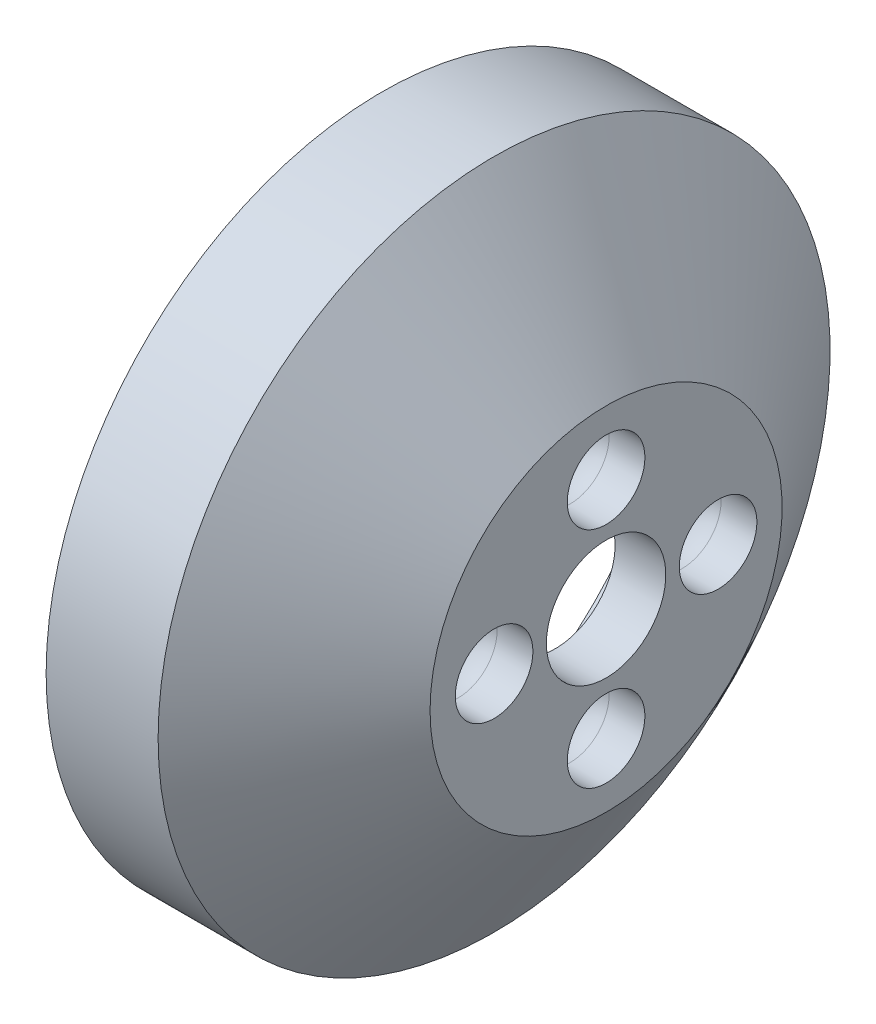
from build123d import *

# Parameters (mm, degrees)
SKETCH2_R          = 6.604
CUT_EXTRUDE1_DEPTH = 12.7
FILLET1_R          = 6.604
CHAMFER1_SIZE      = 33.02
CHAMFER1_SIZE2     = 23.120852912


with BuildPart() as part:
    # Sketch1 → Revolve1 (revolve)
    with BuildSketch(Plane.XY, mode=Mode.PRIVATE) as revolve1_sk:
        Polygon((0, 51.054), (0, 10.16), (31.75, 10.16), (31.75, 29.943780472), (12.7, 57.15), (-6.35, 57.15), (-6.35, 51.054), align=None)
    revolve(revolve1_sk.sketch.rotate(Axis((0, 0, 0), (1, 0, 0)), 90), axis=Axis((0, 0, 0), (1, 0, 0)))

    # Sketch2 → Cut-Extrude1 (cut)
    with BuildSketch(Plane(origin=(31.75, 0, 0), x_dir=(0, 0, -1), z_dir=(1, 0, 0))):
        with Locations((-19.05, 0)):
            Circle(SKETCH2_R)
        with Locations((0, 19.05)):
            Circle(SKETCH2_R)
        with Locations((19.05, 0)):
            Circle(SKETCH2_R)
        with Locations((0, -19.05)):
            Circle(SKETCH2_R)
    extrude(amount=-CUT_EXTRUDE1_DEPTH, mode=Mode.SUBTRACT)

    # Fillet1
    fillet1_edges = [part.edges().sort_by_distance(p)[0] for p in [
        (19.05, 0, 25.654),
        (19.05, 19.05, 6.604),
        (19.05, 0, -12.446),
        (19.05, -19.05, 6.604),
    ]]
    fillet(fillet1_edges, radius=FILLET1_R)

    # Chamfer1
    chamfer1_edges = [part.edges().sort_by_distance(p)[0] for p in [
        (0, 0, -10.16),
    ]]
    chamfer1_side = [part.faces().sort_by_distance(p)[0] for p in [
        (0, 0, -49.609974816),
    ]]
    chamfer(chamfer1_edges, length=CHAMFER1_SIZE, length2=CHAMFER1_SIZE2, reference=chamfer1_side[0])


solid = part.part
